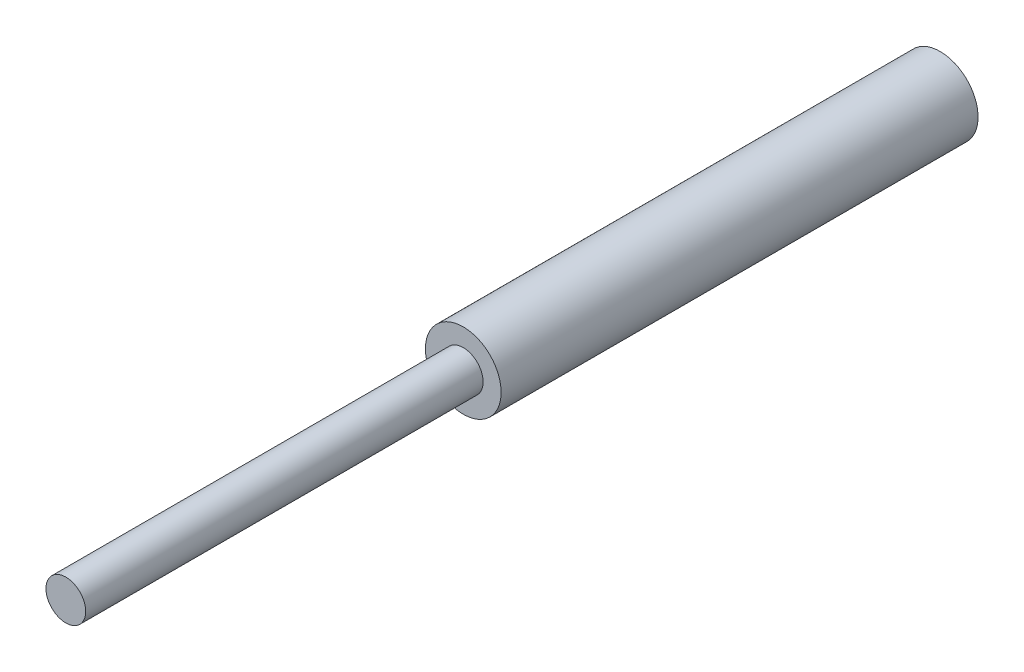
from build123d import *

# Parameters (mm, degrees)
SKETCH2_R           = 2.5
BOSS_EXTRUDE1_DEPTH = 50
SKETCH3_R           = 4.7625
BOSS_EXTRUDE2_DEPTH = 60


with BuildPart() as part:
    # Sketch2 → Boss-Extrude1 (new body)
    with BuildSketch(Plane.XY):
        Circle(SKETCH2_R)
    extrude(amount=BOSS_EXTRUDE1_DEPTH)

    # Sketch3 → Boss-Extrude2 (add)
    with BuildSketch(Plane(origin=(0, 0, 0), x_dir=(-1, 0, 0), z_dir=(0, 0, -1))):
        Circle(SKETCH3_R)
    extrude(amount=BOSS_EXTRUDE2_DEPTH)


solid = part.part
